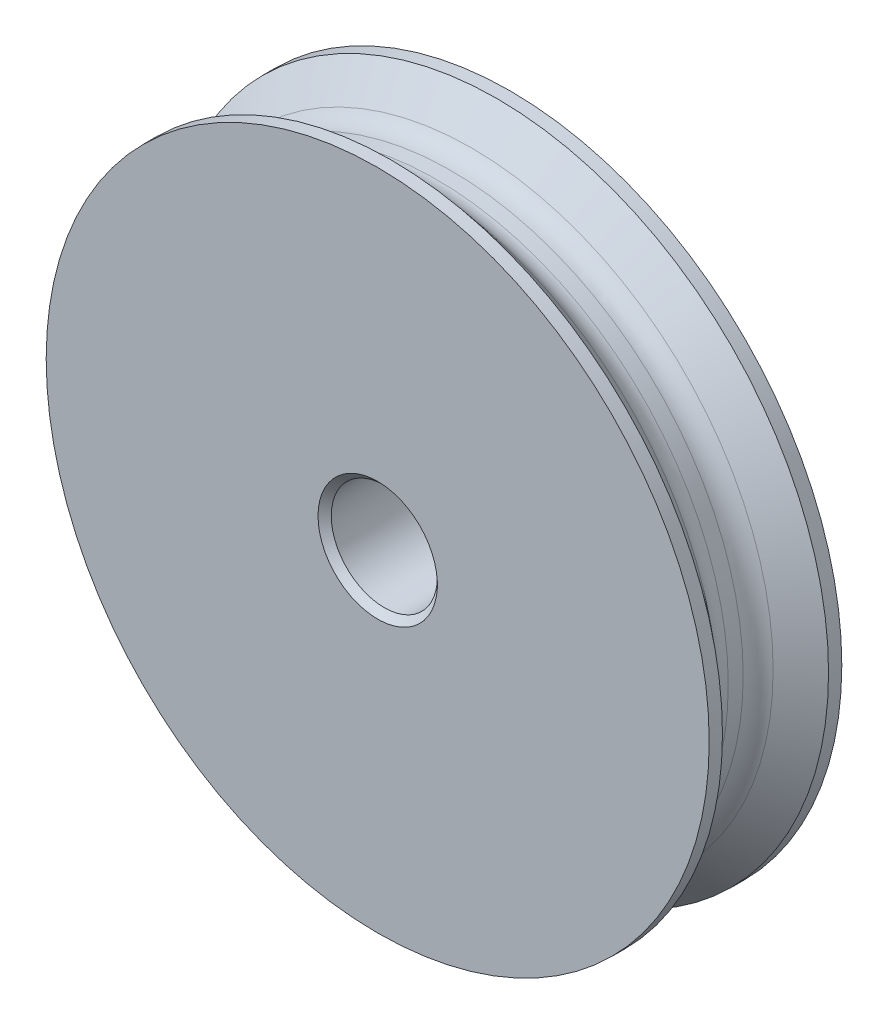
from build123d import *

# Parameters (mm, degrees)
ZAOKR_GLENIE1_R  = 2
SFAZOWANIE1_SIZE = 0.5


with BuildPart() as part:
    # Szkic1 → Obrót1 (revolve)
    with BuildSketch(Plane(origin=(0, 0, 0), x_dir=(0, 0, -1), z_dir=(1, 0, 0)), mode=Mode.PRIVATE) as obr_t1_sk:
        Polygon((-5, 4), (5, 4), (5, 25), (4, 25), (1.5, 22), (-1.5, 22), (-4, 25), (-5, 25), align=None)
    revolve(obr_t1_sk.sketch.rotate(Axis((0, 0, 0), (0, 0, -1)), 90), axis=Axis((0, 0, 0), (0, 0, -1)))

    # Zaokrąglenie1
    zaokr_glenie1_edges = [part.edges().sort_by_distance(p)[0] for p in [
        (-22, 0, -1.5),
        (-22, 0, 1.5),
    ]]
    fillet(zaokr_glenie1_edges, radius=ZAOKR_GLENIE1_R)

    # Sfazowanie1
    sfazowanie1_edges = [part.edges().sort_by_distance(p)[0] for p in [
        (-4, 0, 5),
        (-4, 0, -5),
    ]]
    chamfer(sfazowanie1_edges, length=SFAZOWANIE1_SIZE)


solid = part.part
